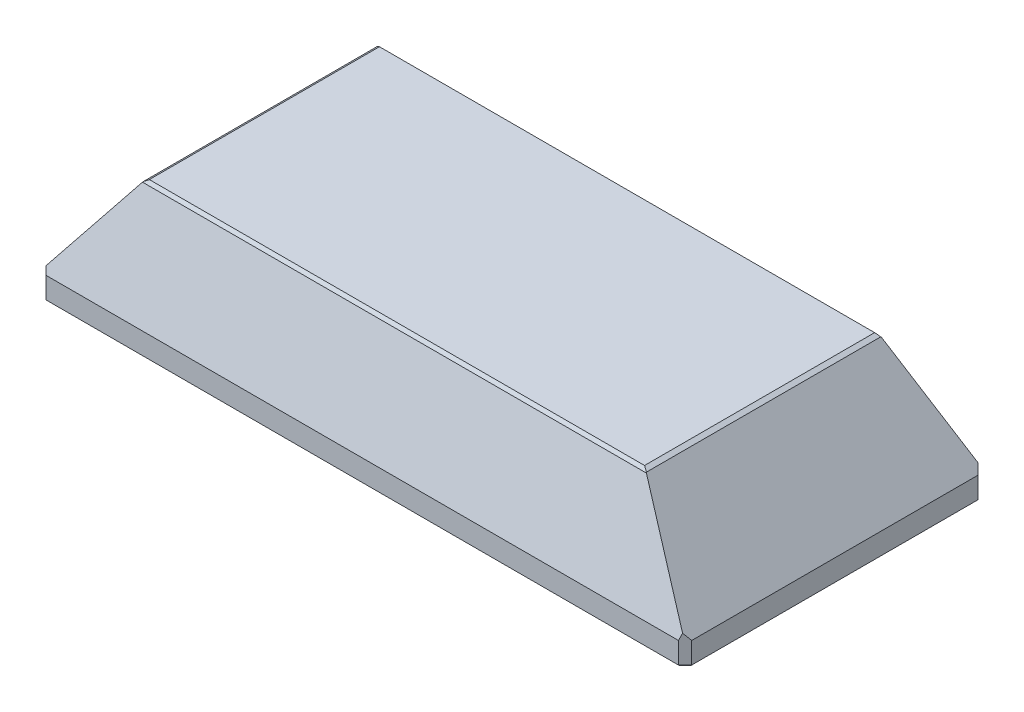
from build123d import *
from OCP.BRepFilletAPI import BRepFilletAPI_MakeChamfer

# Parameters (mm, degrees)
SKETCH1_W                       = 194
SKETCH1_H                       = 90
BOSS_EXTRUDE1_DEPTH             = 7
CHAMFER1_SIZE                   = 2
SKETCH4_R                       = 2.15
CUT_EXTRUDE1_DEPTH              = 7
SKETCH5_W                       = 150
SKETCH5_H                       = 60
CUT_EXTRUDE2_DEPTH              = 36
SKETCH6_W                       = 150
SKETCH6_H                       = 64
CUT_EXTRUDE3_DEPTH              = 32
SKETCH7_W                       = 6
SKETCH7_H                       = 64
CUT_EXTRUDE4_DEPTH              = 4
SKETCH8_R                       = 2.05
CUT_EXTRUDE5_DEPTH              = 6
CHAMFER2_SIZE                   = 1
CHAMFER2_SIZE2                  = 0.615681714
CHAMFER2_SIZE2_2                = 0.436631997
CHAMFER3_SIZE                   = 0.6
SKIZZE1_W                       = 54.050484576
SKIZZE1_H                       = 12.5
SKIZZE1_W_2                     = 40
SKIZZE1_H_2                     = 21.453027382
AUFSATZ_LINEAR_AUSTRAGEN1_DEPTH = 10
SKIZZE3_W                       = 47.974757712
SKIZZE3_H                       = 1
SCHNITT_LINEAR_AUSTRAGEN2_DEPTH = 4
SKETCH9_W                       = 150
SKETCH9_H                       = 64
CUT_EXTRUDE6_DEPTH              = 32
CHAMFER4_SIZE                   = 0.4


with BuildPart() as part:
    # Sketch1 → Boss-Extrude1 (new body)
    with BuildSketch(Plane(origin=(0, 0, 0), x_dir=(1, 0, 0), z_dir=(0, 1, 0))):
        Rectangle(SKETCH1_W, SKETCH1_H)
    extrude(amount=BOSS_EXTRUDE1_DEPTH)

    # Sketch3 → Loft2 section 0
    with BuildSketch(Plane(origin=(0, 7, 0), x_dir=(1, 0, 0), z_dir=(0, 1, 0))):
        with BuildLine():
            Line((97, -45), (97, 45))
            Line((97, 45), (-97, 45))
            Line((-97, 45), (-97, -45))
            Line((-97, -45), (97, -45))
        make_face()
    # Sketch2 → Loft2 section 1
    with BuildSketch(Plane(origin=(0, 37, 0), x_dir=(1, 0, 0), z_dir=(0, 1, 0))):
        with BuildLine():
            Line((-75, -35), (75, -35))
            Line((75, -35), (75, 35))
            Line((75, 35), (-75, 35))
            Line((-75, 35), (-75, -35))
        make_face()
    loft()

    # Chamfer1
    chamfer1_edges = [part.edges().sort_by_distance(p)[0] for p in [
        (-97, 3.5, 45),
        (97, 3.5, 45),
        (97, 3.5, -45),
        (-97, 3.5, -45),
    ]]
    chamfer(chamfer1_edges, length=CHAMFER1_SIZE)

    # Sketch4 → Cut-Extrude1 (cut)
    with BuildSketch(Plane.XZ):
        with Locations(Location((40, -41.5, 0), (0, 0, 270))):
            Circle(SKETCH4_R)
        with Locations(Location((-40, -41.5, 0), (0, 0, 270))):
            Circle(SKETCH4_R)
    cut_extrude1 = extrude(amount=-CUT_EXTRUDE1_DEPTH, mode=Mode.SUBTRACT)

    # Sketch5 → Cut-Extrude2 (cut)
    with BuildSketch(Plane.XZ):
        Rectangle(SKETCH5_W, SKETCH5_H)
    extrude(amount=-CUT_EXTRUDE2_DEPTH, mode=Mode.SUBTRACT)

    # Mirror1: Cut-Extrude1 across plane
    add(cut_extrude1.mirror(Plane.XY), mode=Mode.SUBTRACT)

    # Sketch6 → Cut-Extrude3 (cut)
    with BuildSketch(Plane.XZ):
        Rectangle(SKETCH6_W, SKETCH6_H)
    extrude(amount=-CUT_EXTRUDE3_DEPTH, mode=Mode.SUBTRACT)

    # Sketch7 → Cut-Extrude4 (cut)
    with BuildSketch(Plane.XZ):
        with Locations((-78, 0)):
            Rectangle(SKETCH7_W, SKETCH7_H)
        with Locations((78, 0)):
            Rectangle(SKETCH7_W, SKETCH7_H)
    extrude(amount=-CUT_EXTRUDE4_DEPTH, mode=Mode.SUBTRACT)

    # Sketch8 → Cut-Extrude5 (cut)
    with BuildSketch(Plane.XZ.offset(-4)):
        with Locations(Location((-78, 25, 0), (0, 0, 270))):
            Circle(SKETCH8_R)
        with Locations(Location((-78, -25, 0), (0, 0, 270))):
            Circle(SKETCH8_R)
        with Locations(Location((78, -25, 0), (0, 0, 90))):
            Circle(SKETCH8_R)
        with Locations(Location((78, 25, 0), (0, 0, 90))):
            Circle(SKETCH8_R)
    extrude(amount=-CUT_EXTRUDE5_DEPTH, mode=Mode.SUBTRACT)

    # Chamfer2: one chamfer whose edges measure the first distance from different faces: ONE call of the kernel's chamfer builder (chamfer() names one face for all edges)
    chamfer2_edges_1 = [part.edges().sort_by_distance(p)[0] for p in [
        (75, 37, 0),
    ]]
    chamfer2_side_1 = [part.faces().sort_by_distance(p)[0] for p in [
        (86.442553469, 21.396517997, 0),
    ]]
    chamfer2_edges_2 = [part.edges().sort_by_distance(p)[0] for p in [
        (0, 37, -35),
    ]]
    chamfer2_side_2 = [part.faces().sort_by_distance(p)[0] for p in [
        (0, 21.370454545, -40.209848485),
    ]]
    chamfer2_edges_3 = [part.edges().sort_by_distance(p)[0] for p in [
        (-75, 37, 0),
    ]]
    chamfer2_side_3 = [part.faces().sort_by_distance(p)[0] for p in [
        (-86.442553469, 21.396517997, 0),
    ]]
    chamfer2_edges_4 = [part.edges().sort_by_distance(p)[0] for p in [
        (0, 37, 35),
    ]]
    chamfer2_side_4 = [part.faces().sort_by_distance(p)[0] for p in [
        (0, 21.370454545, 40.209848485),
    ]]
    chamfer2 = BRepFilletAPI_MakeChamfer(part.part.solid().wrapped)
    for e in chamfer2_edges_1:
        chamfer2.Add(CHAMFER2_SIZE, CHAMFER2_SIZE2, e.wrapped, chamfer2_side_1[0].wrapped)  # the first distance lies on this face
    for e in chamfer2_edges_2:
        chamfer2.Add(CHAMFER2_SIZE, CHAMFER2_SIZE2_2, e.wrapped, chamfer2_side_2[0].wrapped)  # the first distance lies on this face
    for e in chamfer2_edges_3:
        chamfer2.Add(CHAMFER2_SIZE, CHAMFER2_SIZE2, e.wrapped, chamfer2_side_3[0].wrapped)  # the first distance lies on this face
    for e in chamfer2_edges_4:
        chamfer2.Add(CHAMFER2_SIZE, CHAMFER2_SIZE2_2, e.wrapped, chamfer2_side_4[0].wrapped)  # the first distance lies on this face
    add(Compound.cast(chamfer2.Shape()), mode=Mode.REPLACE)

    # Chamfer3
    chamfer3_edges = [part.edges().sort_by_distance(p)[0] for p in [
        (0, 0, 45),
        (97, 0, 0),
        (-97, 0, 0),
        (0, 0, -45),
        (-96, 0, -44),
        (96, 0, -44),
        (96, 0, 44),
        (-96, 0, 44),
    ]]
    chamfer(chamfer3_edges, length=CHAMFER3_SIZE)

    # Skizze1 → Aufsatz-Linear austragen1 (add)
    with BuildSketch(Plane.XZ.offset(-36)):
        with Locations((0, -23.75)):
            Rectangle(SKIZZE1_W, SKIZZE1_H)
        with Locations((0, 23.75)):
            Rectangle(SKIZZE1_W, SKIZZE1_H)
        with Locations((55, 0)):
            Rectangle(SKIZZE1_W_2, SKIZZE1_H_2)
    extrude(amount=AUFSATZ_LINEAR_AUSTRAGEN1_DEPTH)

    # Skizze3 → Schnitt-Linear austragen2 (cut)
    with BuildSketch(Plane(origin=(0, 36, 0), x_dir=(-1, 0, 0), z_dir=(0, -1, 0))):
        with Locations((51.012621144, -30.5)):
            Rectangle(SKIZZE3_W, SKIZZE3_H)
        with Locations((-51.012621144, -30.5)):
            Rectangle(SKIZZE3_W, SKIZZE3_H)
        with Locations((51.012621144, 30.5)):
            Rectangle(SKIZZE3_W, SKIZZE3_H)
        with Locations((-51.012621144, 30.5)):
            Rectangle(SKIZZE3_W, SKIZZE3_H)
    extrude(amount=SCHNITT_LINEAR_AUSTRAGEN2_DEPTH, mode=Mode.SUBTRACT)

    # Sketch9 → Cut-Extrude6 (cut)
    with BuildSketch(Plane.XZ.offset(-4)):
        Rectangle(SKETCH9_W, SKETCH9_H)
    extrude(amount=-CUT_EXTRUDE6_DEPTH, mode=Mode.SUBTRACT)

    # Chamfer4
    chamfer4_edges = [part.edges().sort_by_distance(p)[0] for p in [
        (40, 0, -39.35),
        (-40, 0, -39.35),
        (40, 0, 39.35),
        (-40, 0, 39.35),
    ]]
    chamfer(chamfer4_edges, length=CHAMFER4_SIZE)


solid = part.part
